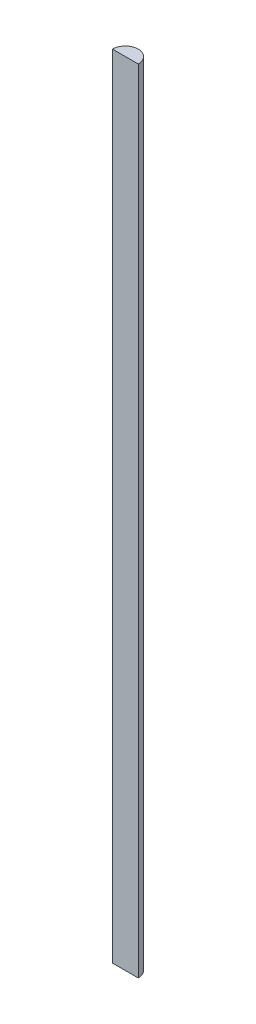
from build123d import *

# Parameters (mm, degrees)
RESSALTO_EXTRUS_O1_DEPTH = 150


with BuildPart() as part:
    # Esboço1 → Ressalto-extrusão1 (new body)
    with BuildSketch(Plane(origin=(0, 0, 0), x_dir=(1, 0, 0), z_dir=(0, 1, 0))):
        with BuildLine():
            Line((-2.45, 0), (2.45, 0))
            ThreePointArc((2.45, 0), (0, 2.45), (-2.45, 0))
        make_face()
    extrude(amount=RESSALTO_EXTRUS_O1_DEPTH)


solid = part.part
